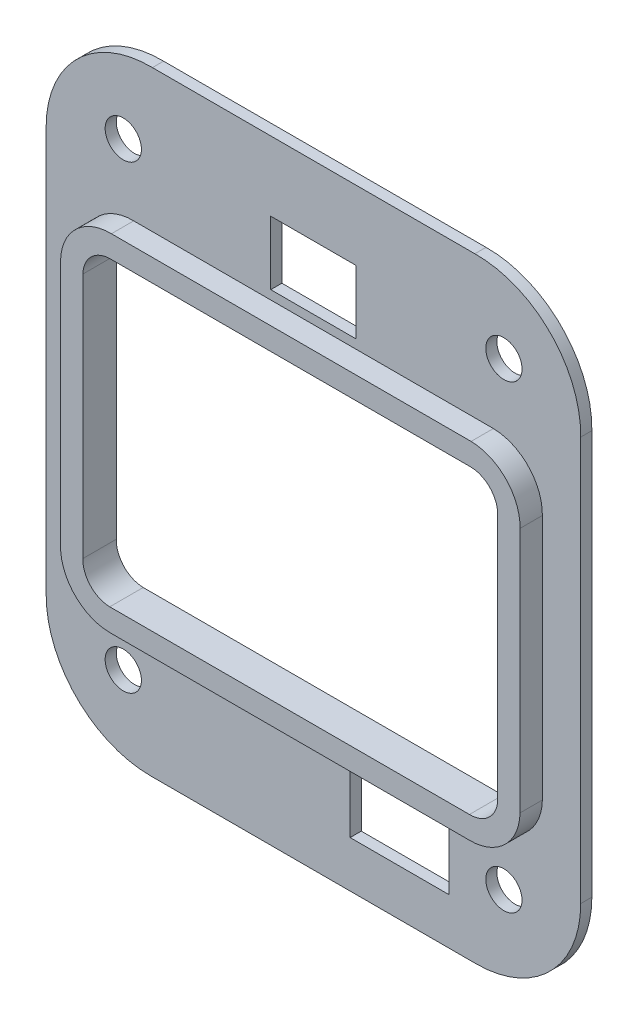
from build123d import *

# Parameters (mm, degrees)
MODEL_R             = 1.62599878
MODEL_W             = 8.89
MODEL_H             = 6.096
EXTRUDE_1_DEPTH     = 1
EXTRUDE_2_DEPTH     = 3
SKETCH_1_W          = 8.89
SKETCH_1_H          = 1
EXTRUDE_3_DEPTH     = 0.5
SKETCH_2_W          = 1
SKETCH_2_H          = 5.207
EXTRUDE_4_DEPTH     = 0.5
SKETCH_3_W          = 1
SKETCH_3_H          = 5.207
EXTRUDE_5_DEPTH     = 0.5
SKETCH_4_W          = 7.636
SKETCH_4_H          = 1
CUT_EXTRUDE_1_DEPTH = 0.5


with BuildPart() as part:
    # Model → 凸台-拉伸1 (new body)
    with BuildSketch(Plane.XY):
        with BuildLine():
            ThreePointArc((112.78719886, 57.69339998), (119.410096357, 60.436638183), (122.15333456, 67.05953568))
            Line((122.15333456, 67.05953568), (122.15333456, 103.29453306))
            ThreePointArc((122.15333456, 103.29453306), (119.410664993, 110.045001733), (112.66019632, 112.7876713))
            Line((112.66019632, 112.7876713), (83.7431777, 112.7876713))
            ThreePointArc((83.7431777, 112.7876713), (77.016609687, 110.107501601), (74.21120032, 103.43219598))
            Line((74.21120032, 103.43219598), (74.21120032, 67.1865433))
            ThreePointArc((74.21120032, 67.1865433), (76.909728462, 60.481379821), (83.57819454, 57.69339998))
            Line((83.57819454, 57.69339998), (112.78719886, 57.69339998))
        make_face()
        with Locations((81.12722408, 64.6938)):
            Circle(MODEL_R, mode=Mode.SUBTRACT)
        with BuildLine():
            ThreePointArc((81.893126204, 68.992997458), (78.752768, 70.36450237), (77.502, 73.554871436))
            Line((77.502, 73.554871436), (77.502, 95.652871369))
            ThreePointArc((77.502, 95.652871369), (78.87350371, 98.793228241), (82.063870472, 100.043997462))
            Line((82.063870472, 100.043997462), (114.321868602, 100.044000002))
            ThreePointArc((114.321868602, 100.044000002), (117.462140632, 98.672585067), (118.713, 95.482375327))
            Line((118.713, 95.482375327), (118.713, 73.384126091))
            ThreePointArc((118.713, 73.384126091), (117.34149629, 70.243769219), (114.151129528, 68.992999998))
            Line((114.151129528, 68.992999998), (81.893126204, 68.992997458))
        make_face(mode=Mode.SUBTRACT)
        with Locations((105.918, 64.897)):
            Rectangle(MODEL_W, MODEL_H, mode=Mode.SUBTRACT)
        with Locations((115.26482408, 64.6938)):
            Circle(MODEL_R, mode=Mode.SUBTRACT)
        with Locations((81.12722408, 105.9434)):
            Circle(MODEL_R, mode=Mode.SUBTRACT)
        Polygon((93.853, 101.346), (93.853, 106.553), (94.615, 106.553), (102.489, 106.553), (102.489, 101.346), align=None, mode=Mode.SUBTRACT)
        with Locations((115.26482408, 105.9434)):
            Circle(MODEL_R, mode=Mode.SUBTRACT)
    extrude(amount=EXTRUDE_1_DEPTH)

    # Model<3> → 凸台-拉伸2 (add)
    with BuildSketch(Plane.XY):
        with BuildLine():
            Line((77.502, 95.652871369), (77.502, 73.554871436))
            ThreePointArc((77.502, 73.554871436), (78.752768, 70.36450237), (81.893126204, 68.992997458))
            Line((81.893126204, 68.992997458), (114.151129528, 68.992999998))
            ThreePointArc((114.151129528, 68.992999998), (117.34149629, 70.243769219), (118.713, 73.384126091))
            Line((118.713, 73.384126091), (118.713, 95.482375327))
            ThreePointArc((118.713, 95.482375327), (117.462140632, 98.672585067), (114.321868602, 100.044000002))
            Line((114.321868602, 100.044000002), (82.063870472, 100.043997462))
            ThreePointArc((82.063870472, 100.043997462), (78.87350371, 98.793228241), (77.502, 95.652871369))
        make_face()
        with BuildLine():
            ThreePointArc((81.91499746, 70.99299746), (80.182446941, 71.763250556), (79.502, 73.533))
            Line((79.502, 73.533), (79.502, 95.631))
            ThreePointArc((79.502, 95.631), (80.272252197, 97.363549602), (82.042, 98.04399746))
            Line((82.042, 98.04399746), (114.29999746, 98.044))
            ThreePointArc((114.29999746, 98.044), (116.032484318, 97.273814255), (116.713, 95.50418288))
            Line((116.713, 95.50418288), (116.713, 73.40599746))
            ThreePointArc((116.713, 73.40599746), (115.942747803, 71.673447858), (114.173, 70.993))
            Line((114.173, 70.993), (81.91499746, 70.99299746))
        make_face(mode=Mode.SUBTRACT)
    extrude(amount=EXTRUDE_2_DEPTH)

    # 草图1 → 凸台-拉伸3 (add)
    with BuildSketch(Plane.XZ.offset(-67.945)):
        with Locations((105.918, 0.5)):
            Rectangle(SKETCH_1_W, SKETCH_1_H)
    extrude(amount=EXTRUDE_3_DEPTH)

    # 草图2 → 凸台-拉伸4 (add)
    with BuildSketch(Plane(origin=(93.853, 0, 0), x_dir=(0, 0, -1), z_dir=(1, 0, 0))):
        with Locations((-0.5, 103.9495)):
            Rectangle(SKETCH_2_W, SKETCH_2_H)
    extrude(amount=EXTRUDE_4_DEPTH)

    # 草图3 → 凸台-拉伸5 (add)
    with BuildSketch(Plane.ZY.offset(-102.489)):
        with Locations((0.5, 103.9495)):
            Rectangle(SKETCH_3_W, SKETCH_3_H)
    extrude(amount=EXTRUDE_5_DEPTH)

    # 草图4 → 切除-拉伸1 (cut)
    with BuildSketch(Plane(origin=(0, 101.346, 0), x_dir=(1, 0, 0), z_dir=(0, 1, 0))):
        with Locations((98.171, -0.5)):
            Rectangle(SKETCH_4_W, SKETCH_4_H)
    extrude(amount=-CUT_EXTRUDE_1_DEPTH, mode=Mode.SUBTRACT)


solid = part.part
